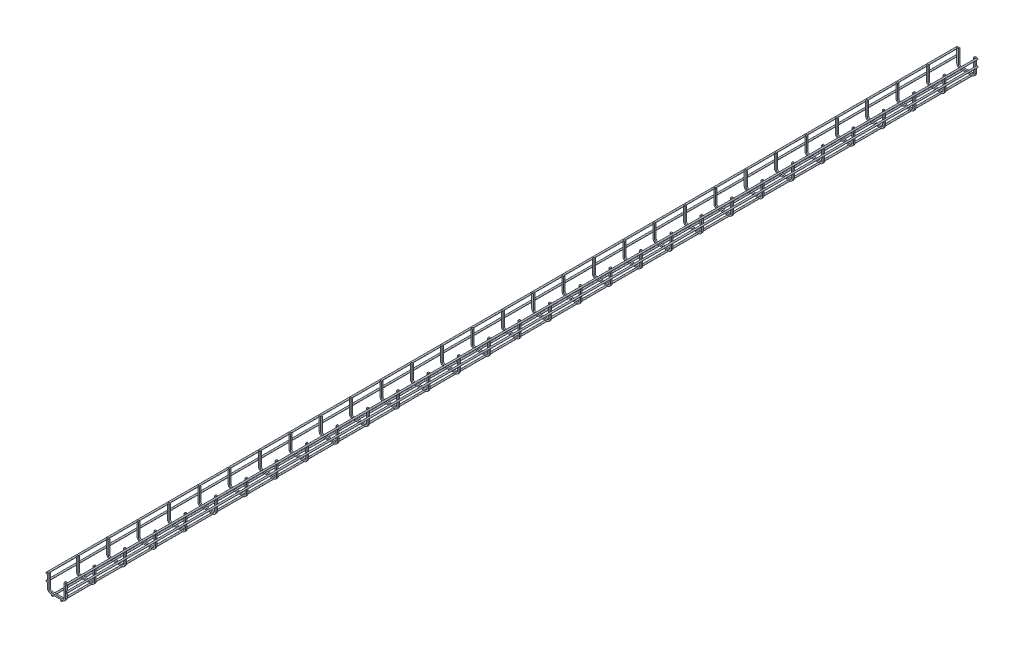
from build123d import *

# Parameters (mm, degrees)
BASIS_LINEAR_AUSTRAGEN_DEPTH    = 1500
SCHNITT_LINEAR_START            = 100
SCHNITT_LINEAR_AUSTRAGEN1_DEPTH = 95
LINEARES_MUSTER1_COUNT          = 30
LINEARES_MUSTER1_PITCH          = 100
AUFSATZ_LINEAR_AUSTRAGEN1_DEPTH = 5


with BuildPart() as part:
    # Skizze1 → Basis-Linear austragen (new, symmetric)
    with BuildSketch(Plane.XY):
        with BuildLine():
            Line((-30, 59.999), (-30, 57.569703607))
            ThreePointArc((-30, 57.569703607), (-34.999, 57.499), (-30, 57.428296393))
            Line((-30, 57.428296393), (-30, 35.069703607))
            ThreePointArc((-30, 35.069703607), (-34.999, 34.999), (-30, 34.928296393))
            Line((-30, 34.928296393), (-30, 14.999))
            ThreePointArc((-30, 14.999), (-27.071067812, 7.927932188), (-20, 4.999))
            Line((-20, 4.999), (-15, 4.999))
            ThreePointArc((-15, 4.999), (-14.929296393, 0), (-14.858592787, 4.999))
            Line((-14.858592787, 4.999), (14.858592787, 4.999))
            ThreePointArc((14.858592787, 4.999), (14.929296393, 0), (15, 4.999))
            Line((15, 4.999), (20, 4.999))
            ThreePointArc((20, 4.999), (27.071067812, 7.927932188), (30, 14.999))
            Line((30, 14.999), (30, 34.928296393))
            ThreePointArc((30, 34.928296393), (34.999, 34.999), (30, 35.069703607))
            Line((30, 35.069703607), (30, 57.428296393))
            ThreePointArc((30, 57.428296393), (34.999, 57.499), (30, 57.569703607))
            Line((30, 57.569703607), (30, 59.999))
            Line((30, 59.999), (25, 59.999))
            Line((25, 59.999), (25, 14.999))
            ThreePointArc((25, 14.999), (23.535533906, 11.463466094), (20, 9.999))
            Line((20, 9.999), (-20, 9.999))
            ThreePointArc((-20, 9.999), (-23.535533906, 11.463466094), (-25, 14.999))
            Line((-25, 14.999), (-25, 59.999))
            Line((-25, 59.999), (-30, 59.999))
        make_face()
    extrude(amount=BASIS_LINEAR_AUSTRAGEN_DEPTH, both=True)

    # Skizze2 → Schnitt-Linear austragen1 (cut)
    with BuildSketch(Plane.XY.offset(-1500).offset(SCHNITT_LINEAR_START)):
        with BuildLine():
            Line((30, 59.999), (25, 59.999))
            Line((25, 59.999), (25, 14.999))
            ThreePointArc((25, 14.999), (23.535533906, 11.463466094), (20, 9.999))
            Line((20, 9.999), (-20, 9.999))
            ThreePointArc((-20, 9.999), (-23.535533906, 11.463466094), (-25, 14.999))
            Line((-25, 14.999), (-25, 59.999))
            Line((-25, 59.999), (-30, 59.999))
            Line((-30, 59.999), (-30, 14.999))
            ThreePointArc((-30, 14.999), (-27.071067812, 7.927932188), (-20, 4.999))
            Line((-20, 4.999), (20, 4.999))
            ThreePointArc((20, 4.999), (27.071067812, 7.927932188), (30, 14.999))
            Line((30, 14.999), (30, 59.999))
        make_face()
    schnitt_linear_austragen1 = extrude(amount=-SCHNITT_LINEAR_AUSTRAGEN1_DEPTH, mode=Mode.SUBTRACT)

    # Lineares Muster1: Schnitt-Linear austragen1 ×30
    with Locations(*[(0, 0, i * LINEARES_MUSTER1_PITCH) for i in range(1, LINEARES_MUSTER1_COUNT)]):
        add(schnitt_linear_austragen1, mode=Mode.SUBTRACT)

    # Skizze3 → Aufsatz-Linear austragen1 (add)
    with BuildSketch(Plane.XY.offset(1500)):
        with BuildLine():
            Line((-20, 4.999), (-15, 4.999))
            Line((-15, 4.999), (-14.858592786, 4.999))
            Line((-14.858592786, 4.999), (14.858592787, 4.999))
            Line((14.858592787, 4.999), (15, 4.999))
            Line((15, 4.999), (20, 4.999))
            ThreePointArc((20, 4.999), (27.071067812, 7.927932188), (30, 14.999))
            Line((30, 14.999), (30, 34.928296393))
            Line((30, 34.928296393), (30, 35.069703607))
            Line((30, 35.069703607), (30, 57.428296393))
            Line((30, 57.428296393), (30, 57.569703607))
            Line((30, 57.569703607), (30, 59.999))
            Line((30, 59.999), (25, 59.999))
            Line((25, 59.999), (25, 14.999))
            ThreePointArc((25, 14.999), (23.535533906, 11.463466094), (20, 9.999))
            Line((20, 9.999), (-20, 9.999))
            ThreePointArc((-20, 9.999), (-23.535533906, 11.463466094), (-25, 14.999))
            Line((-25, 14.999), (-25, 59.999))
            Line((-25, 59.999), (-30, 59.999))
            Line((-30, 59.999), (-30, 57.569703607))
            Line((-30, 57.569703607), (-30, 57.428296393))
            Line((-30, 57.428296393), (-30, 35.069703607))
            Line((-30, 35.069703607), (-30, 34.928296393))
            Line((-30, 34.928296393), (-30, 14.999))
            ThreePointArc((-30, 14.999), (-27.071067812, 7.927932188), (-20, 4.999))
        make_face()
    extrude(amount=-AUFSATZ_LINEAR_AUSTRAGEN1_DEPTH)


solid = part.part
